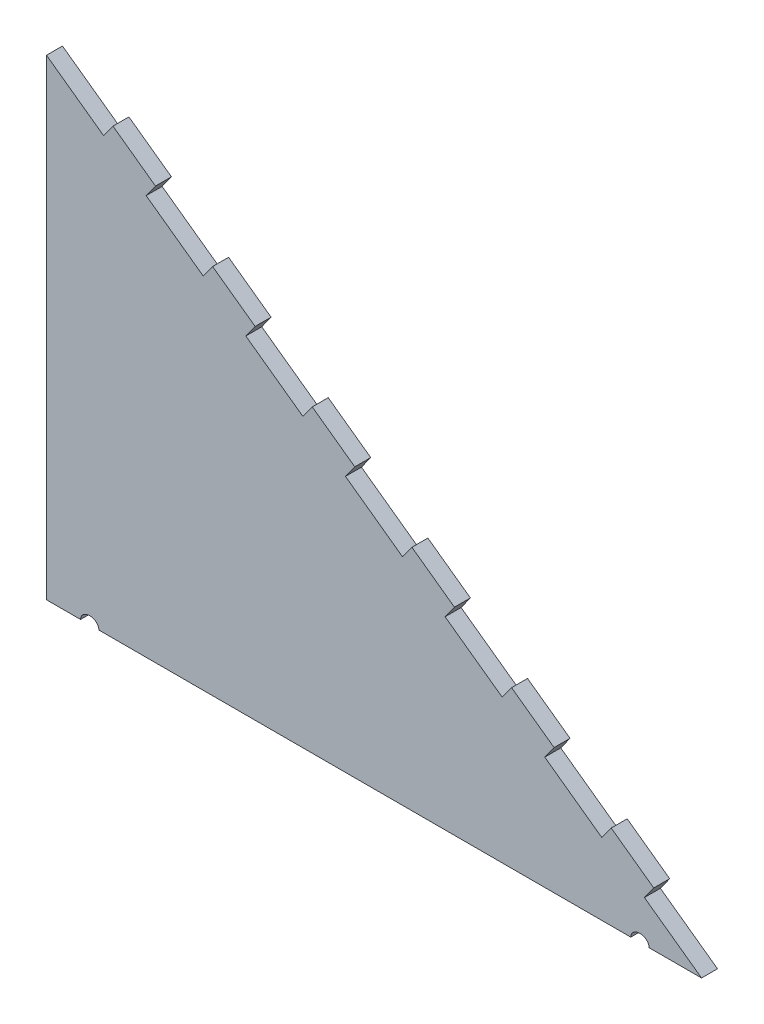
from build123d import *

# Parameters (mm, degrees)
BOSS_EXTRUDE1_DEPTH = 6.096


with BuildPart() as part:
    # Sketch1 → Boss-Extrude1 (new body)
    with BuildSketch(Plane.XY):
        with BuildLine():
            Line((0, 0), (13, 0))
            add(Edge.make_bspline(
                [(20, 0), (20, 3), (16.5, 3), (13, 3), (13, 0)],
                knots=[3.141592654, 3.141592654, 3.141592654, 4.71238898, 4.71238898, 6.283185307, 6.283185307, 6.283185307], degree=2, weights=[1, 0.707106781, 1, 0.707106781, 1]))
            Line((20, 0), (223, 0))
            add(Edge.make_bspline(
                [(230, 0), (230, 3), (226.5, 3), (223, 3), (223, 0)],
                knots=[3.141592654, 3.141592654, 3.141592654, 4.71238898, 4.71238898, 6.283185307, 6.283185307, 6.283185307], degree=2, weights=[1, 0.707106781, 1, 0.707106781, 1]))
            Line((230, 0), (250, 0))
            Line((250, 0), (228.197731568, 15.697633271))
            Line((228.197731568, 15.697633271), (231.759653176, 20.644746617))
            Line((231.759653176, 20.644746617), (215.528966347, 32.330841134))
            Line((215.528966347, 32.330841134), (211.967044739, 27.383727788))
            Line((211.967044739, 27.383727788), (190.164776306, 43.081361059))
            Line((190.164776306, 43.081361059), (193.726697915, 48.028474405))
            Line((193.726697915, 48.028474405), (177.496011086, 59.714568922))
            Line((177.496011086, 59.714568922), (173.934089477, 54.767455576))
            Line((173.934089477, 54.767455576), (152.131821045, 70.465088847))
            Line((152.131821045, 70.465088847), (155.693742654, 75.412202193))
            Line((155.693742654, 75.412202193), (139.463055825, 87.09829671))
            Line((139.463055825, 87.09829671), (135.901134216, 82.151183364))
            Line((135.901134216, 82.151183364), (114.098865784, 97.848816636))
            Line((114.098865784, 97.848816636), (117.660787393, 102.795929981))
            Line((117.660787393, 102.795929981), (101.430100564, 114.482024498))
            Line((101.430100564, 114.482024498), (97.868178955, 109.534911153))
            Line((97.868178955, 109.534911153), (76.065910523, 125.232544424))
            Line((76.065910523, 125.232544424), (79.627832131, 130.179657769))
            Line((79.627832131, 130.179657769), (63.397145302, 141.865752286))
            Line((63.397145302, 141.865752286), (59.835223694, 136.918638941))
            Line((59.835223694, 136.918638941), (38.032955261, 152.616272212))
            Line((38.032955261, 152.616272212), (41.59487687, 157.563385557))
            Line((41.59487687, 157.563385557), (25.364190041, 169.249480074))
            Line((25.364190041, 169.249480074), (21.802268432, 164.302366729))
            Line((21.802268432, 164.302366729), (0, 180))
            Line((0, 180), (0, 0))
        make_face()
    extrude(amount=BOSS_EXTRUDE1_DEPTH)


solid = part.part
